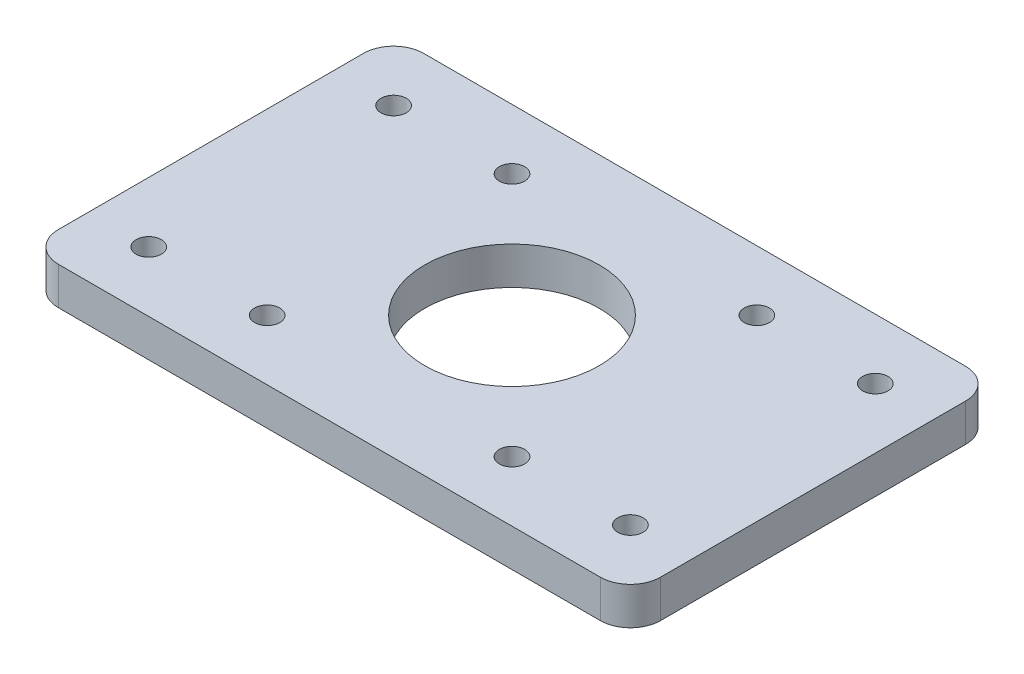
from build123d import *

# Parameters (mm, degrees)
SKETCH1_W           = 76.2
SKETCH1_H           = 46.228
SKETCH1_R           = 1.6
SKETCH1_R_2         = 11.049
BOSS_EXTRUDE1_DEPTH = 4.7625
FILLET1_R           = 3.81


with BuildPart() as part:
    # Sketch1 → Boss-Extrude1 (new body)
    with BuildSketch(Plane(origin=(0, 0, 0), x_dir=(1, 0, 0), z_dir=(0, 1, 0))):
        with Locations((38.1, 23.114)):
            Rectangle(SKETCH1_W, SKETCH1_H)
        with Locations(Location((68.58, 38.608, 0), (0, 0, 90))):
            Circle(SKETCH1_R, mode=Mode.SUBTRACT)
        with Locations(Location((7.62, 38.608, 0), (0, 0, 90))):
            Circle(SKETCH1_R, mode=Mode.SUBTRACT)
        with Locations(Location((68.58, 7.62, 0), (0, 0, 90))):
            Circle(SKETCH1_R, mode=Mode.SUBTRACT)
        with Locations(Location((7.62, 7.62, 0), (0, 0, 90))):
            Circle(SKETCH1_R, mode=Mode.SUBTRACT)
        with Locations(Location((38.1, 23.114, 0), (0, 0, 90))):
            Circle(SKETCH1_R_2, mode=Mode.SUBTRACT)
        with Locations(Location((22.606, 38.608, 0), (0, 0, 90))):
            Circle(SKETCH1_R, mode=Mode.SUBTRACT)
        with Locations(Location((53.594, 38.608, 0), (0, 0, 90))):
            Circle(SKETCH1_R, mode=Mode.SUBTRACT)
        with Locations(Location((22.606, 7.62, 0), (0, 0, 90))):
            Circle(SKETCH1_R, mode=Mode.SUBTRACT)
        with Locations(Location((53.594, 7.62, 0), (0, 0, 90))):
            Circle(SKETCH1_R, mode=Mode.SUBTRACT)
    extrude(amount=BOSS_EXTRUDE1_DEPTH)

    # Fillet1
    fillet1_edges = [part.edges().sort_by_distance(p)[0] for p in [
        (0, 2.38125, -46.228),
        (76.2, 2.38125, -46.228),
        (76.2, 2.38125, 0),
        (0, 2.38125, 0),
    ]]
    fillet(fillet1_edges, radius=FILLET1_R)


solid = part.part
